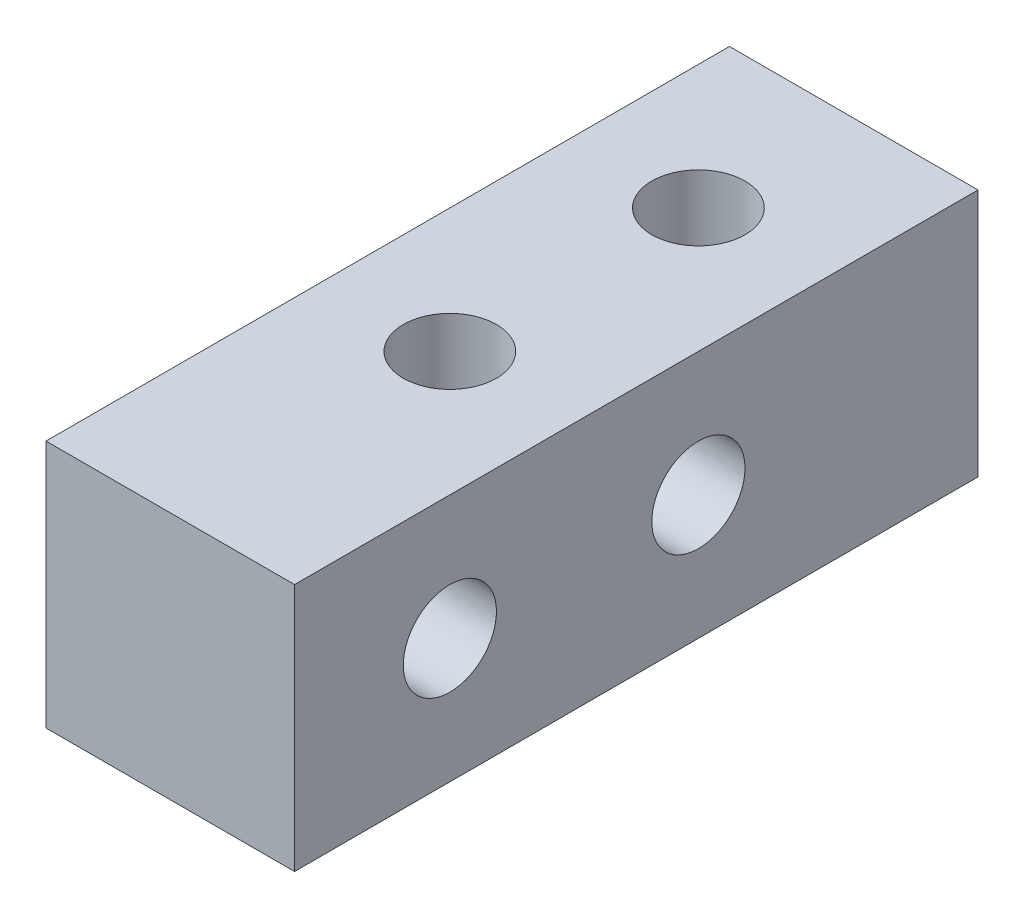
from build123d import *

# Parameters (mm, degrees)
SKETCH_1_W          = 8
SKETCH_1_H          = 8
EXTRUDE_1_DEPTH     = 22
SKETCH_2_R          = 1.5
CUT_EXTRUDE_1_DEPTH = 24.748684174
SKETCH_3_R          = 1.5
CUT_EXTRUDE_2_DEPTH = 22


with BuildPart() as part:
    # 草图1 → 凸台-拉伸1 (new body)
    with BuildSketch(Plane.XY):
        Rectangle(SKETCH_1_W, SKETCH_1_H)
    extrude(amount=EXTRUDE_1_DEPTH)

    # 草图2 → 切除-拉伸1 (cut, through all)
    with BuildSketch(Plane(origin=(4, 0, 0), x_dir=(0, 0, -1), z_dir=(1, 0, 0))):
        with Locations((-17, 0)):
            Circle(SKETCH_2_R)
        with Locations((-9, 0)):
            Circle(SKETCH_2_R)
    extrude(amount=-CUT_EXTRUDE_1_DEPTH, mode=Mode.SUBTRACT)

    # 草图3 → 切除-拉伸2 (cut)
    with BuildSketch(Plane(origin=(0, 4, 0), x_dir=(1, 0, 0), z_dir=(0, 1, 0))):
        with Locations(Location((0, -5, 0), (0, 0, 270))):
            Circle(SKETCH_3_R)
        with Locations(Location((0, -13, 0), (0, 0, 270))):
            Circle(SKETCH_3_R)
    extrude(amount=-CUT_EXTRUDE_2_DEPTH, mode=Mode.SUBTRACT)


solid = part.part
